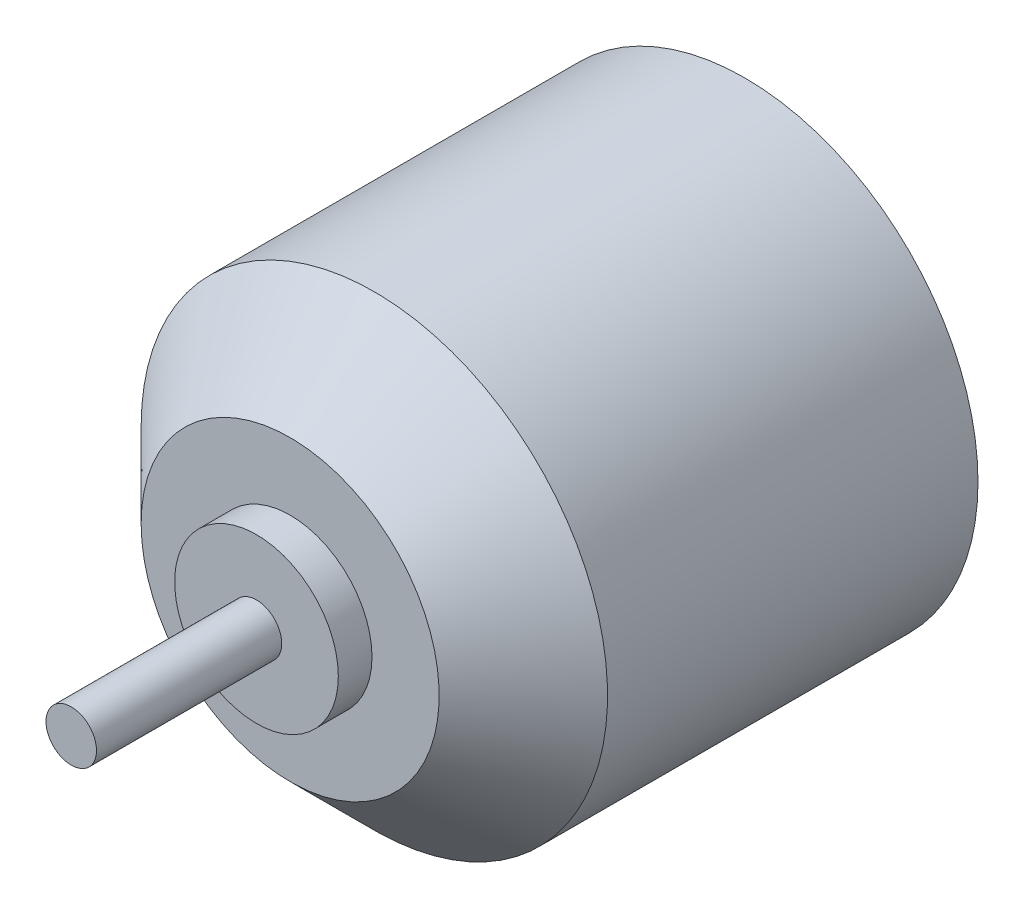
from build123d import *

# Parameters (mm, degrees)
ESQUISSE1_R        = 13.85
BOSS_EXTRU_1_DEPTH = 27
CHANFREIN1_SIZE    = 5
ESQUISSE2_R        = 1.5
BOSS_EXTRU_2_DEPTH = 13
ESQUISSE3_R        = 4.860209202
BOSS_EXTRU_3_DEPTH = 2


with BuildPart() as part:
    # Esquisse1 → Boss.-Extru.1 (new body)
    with BuildSketch(Plane.XY):
        Circle(ESQUISSE1_R)
    extrude(amount=BOSS_EXTRU_1_DEPTH)

    # Chanfrein1
    chanfrein1_edges = [part.edges().sort_by_distance(p)[0] for p in [
        (-13.85, 0, 27),
    ]]
    chamfer(chanfrein1_edges, length=CHANFREIN1_SIZE)

    # Esquisse2 → Boss.-Extru.2 (add)
    with BuildSketch(Plane.XY.offset(27)):
        with Locations(Location((0, 0, 0), (0, 0, 180))):
            Circle(ESQUISSE2_R)
    extrude(amount=BOSS_EXTRU_2_DEPTH)

    # Esquisse3 → Boss.-Extru.3 (add)
    with BuildSketch(Plane.XY.offset(27)):
        Circle(ESQUISSE3_R)
    extrude(amount=BOSS_EXTRU_3_DEPTH)


solid = part.part
